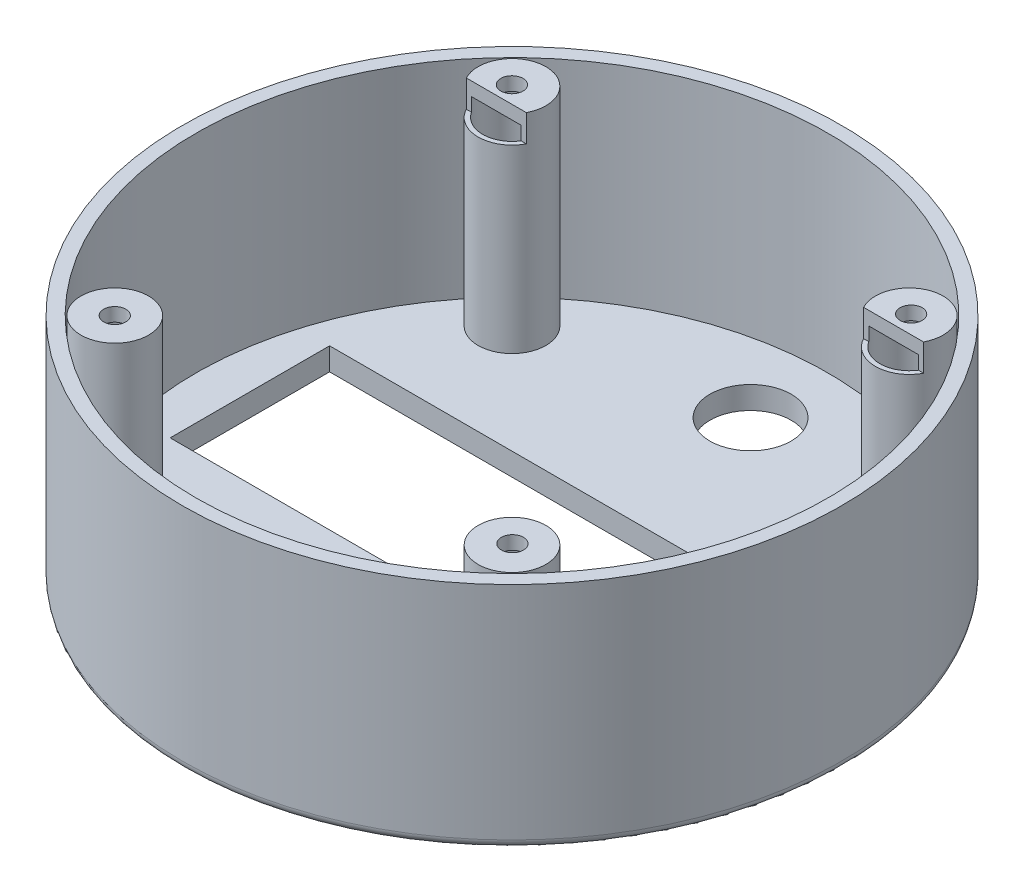
from build123d import *

# Parameters (mm, degrees)
SKETCH2_R           = 36.5
BOSS_EXTRUDE1_DEPTH = 2.5
SKETCH3_R           = 36.5
SKETCH3_R_2         = 35
BOSS_EXTRUDE2_DEPTH = 35
SKETCH4_R           = 3.75
BOSS_EXTRUDE3_DEPTH = 35
SKETCH5_R           = 1.225
CUT_EXTRUDE2_DEPTH  = 64.802429421
CUT_EXTRUDE7_START  = -24
CUT_EXTRUDE7_DEPTH  = 24
FILLET2_R           = 0.75
SKETCH17_R          = 4.5
CUT_EXTRUDE9_DEPTH  = 10
SKETCH19_W          = 60.448509469
SKETCH19_H          = 17.659938419
CUT_EXTRUDE10_DEPTH = 10
FILLET7_R           = 1
CUT_EXTRUDE11_START = -12
SKETCH20_R          = 36.5
CUT_EXTRUDE11_DEPTH = 12
SKETCH21_W          = 50.64390868
SKETCH21_H          = 2.55548202
CUT_EXTRUDE13_DEPTH = 3


with BuildPart() as part:
    # Sketch2 → Boss-Extrude1 (new body)
    with BuildSketch(Plane(origin=(0, 0, 0), x_dir=(1, 0, 0), z_dir=(0, 1, 0))):
        with Locations(Location((0, 0, 0), (0, 0, 270))):
            Circle(SKETCH2_R)
    extrude(amount=BOSS_EXTRUDE1_DEPTH)

    # Sketch3 → Boss-Extrude2 (add)
    with BuildSketch(Plane(origin=(0, 2.5, 0), x_dir=(1, 0, 0), z_dir=(0, 1, 0))):
        with Locations(Location((0, 0, 0), (0, 0, 270))):
            Circle(SKETCH3_R)
        with Locations(Location((0, 0, 0), (0, 0, 270))):
            Circle(SKETCH3_R_2, mode=Mode.SUBTRACT)
    extrude(amount=BOSS_EXTRUDE2_DEPTH)

    # Sketch4 → Boss-Extrude3 (add)
    with BuildSketch(Plane(origin=(0, 2.5, 0), x_dir=(1, 0, 0), z_dir=(0, 1, 0))):
        with Locations(Location((-22, 22, 0), (0, 0, 270))):
            Circle(SKETCH4_R)
        with Locations(Location((22, 22, 0), (0, 0, 270))):
            Circle(SKETCH4_R)
        with Locations(Location((22, -22, 0), (0, 0, 270))):
            Circle(SKETCH4_R)
        with Locations(Location((-22, -22, 0), (0, 0, 270))):
            Circle(SKETCH4_R)
    extrude(amount=BOSS_EXTRUDE3_DEPTH)

    # Sketch5 → Cut-Extrude2 (cut, through all)
    with BuildSketch(Plane(origin=(0, 37.5, 0), x_dir=(1, 0, 0), z_dir=(0, 1, 0))):
        with Locations(Location((-22, -22, 0), (0, 0, 270))):
            Circle(SKETCH5_R)
        with Locations(Location((-22.145028028, 22.135381056, 0), (0, 0, 270))):
            Circle(SKETCH5_R)
        with Locations(Location((21.959827612, 22.246616506, 0), (0, 0, 270))):
            Circle(SKETCH5_R)
        with Locations(Location((21.904209888, -21.858239135, 0), (0, 0, 270))):
            Circle(SKETCH5_R)
    extrude(amount=-CUT_EXTRUDE2_DEPTH, mode=Mode.SUBTRACT)

    # Sketch9 → Cut-Extrude7 (cut)
    with BuildSketch(Plane.XZ.offset(CUT_EXTRUDE7_START)):
        with BuildLine():
            ThreePointArc((25.25, 22), (22, 25.25), (18.75, 22))
            Line((18.75, 22), (20.687440042, 22))
            ThreePointArc((20.687440042, 22), (21.975209673, 23.081179865), (23.129209888, 21.858239135))
            ThreePointArc((23.129209888, 21.858239135), (22.803645235, 21.026589536), (22, 20.63699008))
            Line((22, 20.63699008), (22, 18.75))
            ThreePointArc((22, 18.75), (24.298097039, 19.701902961), (25.25, 22))
        make_face()
        with BuildLine():
            Line((20.687440042, 22), (18.75, 22))
            ThreePointArc((18.75, 22), (19.701902961, 19.701902961), (22, 18.75))
            Line((22, 18.75), (22, 20.63699008))
            ThreePointArc((22, 20.63699008), (21.02182794, 21.008517358), (20.687440042, 22))
        make_face()
        with BuildLine():
            ThreePointArc((25.25, -22), (24.298097039, -19.701902961), (22, -18.75))
            Line((22, -18.75), (22, -21.022275385))
            ThreePointArc((22, -21.022275385), (22.840121931, -21.394732175), (23.184827612, -22.246616506))
            ThreePointArc((23.184827612, -22.246616506), (21.835883306, -23.465330093), (20.75990874, -22))
            Line((20.75990874, -22), (18.75, -22))
            ThreePointArc((18.75, -22), (22, -25.25), (25.25, -22))
        make_face()
        with BuildLine():
            Line((22, -21.022275385), (22, -18.75))
            ThreePointArc((22, -18.75), (19.701902961, -19.701902961), (18.75, -22))
            Line((18.75, -22), (20.75990874, -22))
            ThreePointArc((20.75990874, -22), (21.201382273, -21.284646824), (22, -21.022275385))
        make_face()
        with BuildLine():
            ThreePointArc((-18.75, -22), (-19.701902961, -19.701902961), (-22, -18.75))
            Line((-22, -18.75), (-22, -20.918996302))
            ThreePointArc((-22, -20.918996302), (-21.275395744, -21.272615335), (-20.92753184, -22))
            Line((-20.92753184, -22), (-18.75, -22))
        make_face()
        with BuildLine():
            Line((-22, -20.918996302), (-22, -18.75))
            ThreePointArc((-22, -18.75), (-24.298097039, -24.298097039), (-18.75, -22))
            Line((-18.75, -22), (-20.92753184, -22))
            ThreePointArc((-20.92753184, -22), (-20.92190542, -22.067586629), (-20.920028028, -22.135381056))
            ThreePointArc((-20.920028028, -22.135381056), (-23.061075062, -22.948697005), (-22, -20.918996302))
        make_face()
        with BuildLine():
            ThreePointArc((-22, 20.775), (-22.866205807, 22.866205807), (-20.775, 22))
            Line((-20.775, 22), (-18.75, 22))
            ThreePointArc((-18.75, 22), (-24.298097039, 24.298097039), (-22, 18.75))
            Line((-22, 18.75), (-22, 20.775))
        make_face()
        with BuildLine():
            Line((-18.75, 22), (-20.775, 22))
            ThreePointArc((-20.775, 22), (-21.133794193, 21.133794193), (-22, 20.775))
            Line((-22, 20.775), (-22, 18.75))
            ThreePointArc((-22, 18.75), (-19.701902961, 19.701902961), (-18.75, 22))
        make_face()
    extrude(amount=CUT_EXTRUDE7_DEPTH, mode=Mode.SUBTRACT)

    # Fillet2
    fillet2_edges = [part.edges().sort_by_distance(p)[0] for p in [
        (0, 37.5, -35),
    ]]
    fillet(fillet2_edges, radius=FILLET2_R)

    # Sketch17 → Cut-Extrude9 (cut)
    with BuildSketch(Plane.XZ):
        with Locations(Location((0, -26.418957296, 0), (0, 0, 270))):
            Circle(SKETCH17_R)
    extrude(amount=-CUT_EXTRUDE9_DEPTH, mode=Mode.SUBTRACT)

    # Sketch19 → Cut-Extrude10 (cut)
    with BuildSketch(Plane.XZ):
        with Locations((0.023287933, -1.164693847)):
            Rectangle(SKETCH19_W, SKETCH19_H)
    extrude(amount=-CUT_EXTRUDE10_DEPTH, mode=Mode.SUBTRACT)

    # Fillet7
    fillet7_edges = [part.edges().sort_by_distance(p)[0] for p in [
        (0, 0, -36.5),
    ]]
    fillet(fillet7_edges, radius=FILLET7_R)

    # Sketch20 → Cut-Extrude11 (cut)
    with BuildSketch(Plane(origin=(0, 37.5, 0), x_dir=(1, 0, 0), z_dir=(0, 1, 0)).offset(CUT_EXTRUDE11_START)):
        with Locations(Location((0, 0, 0), (0, 0, 270))):
            Circle(SKETCH20_R)
    extrude(amount=CUT_EXTRUDE11_DEPTH, mode=Mode.SUBTRACT)

    # Sketch21 → Cut-Extrude13 (cut)
    with BuildSketch(Plane(origin=(0, 25.5, 0), x_dir=(1, 0, 0), z_dir=(0, 1, 0))):
        with Locations((0, 18.98239711)):
            Rectangle(SKETCH21_W, SKETCH21_H)
    extrude(amount=-CUT_EXTRUDE13_DEPTH, mode=Mode.SUBTRACT)


solid = part.part
